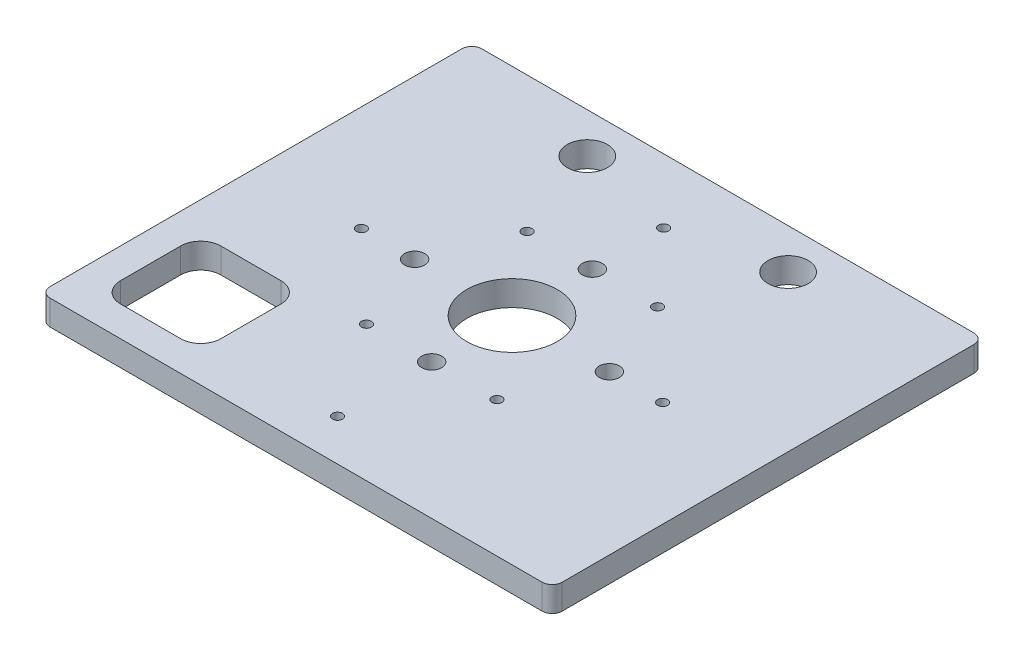
from build123d import *

# Parameters (mm, degrees)
SKETCH1_W           = 51
SKETCH1_H           = 43
SKETCH1_R           = 4.5
SKETCH1_R_2         = 1
SKETCH1_R_3         = 2
SKETCH1_R_4         = 0.5
BOSS_EXTRUDE1_DEPTH = 2.5
FILLET1_R           = 1


with BuildPart() as part:
    # Sketch1 → Boss-Extrude1 (new body)
    with BuildSketch(Plane(origin=(0, 0, 0), x_dir=(1, 0, 0), z_dir=(0, 1, 0))):
        Rectangle(SKETCH1_W, SKETCH1_H)
        with Locations(Location((0, 0, 0), (0, 0, 270))):
            Circle(SKETCH1_R, mode=Mode.SUBTRACT)
        with Locations(Location((9.7, 0, 0), (0, 0, 270))):
            Circle(SKETCH1_R_2, mode=Mode.SUBTRACT)
        with Locations(Location((-9.7, 0, 0), (0, 0, 270))):
            Circle(SKETCH1_R_2, mode=Mode.SUBTRACT)
        with Locations(Location((0, 8, 0), (0, 0, 270))):
            Circle(SKETCH1_R_2, mode=Mode.SUBTRACT)
        with Locations(Location((0, -8, 0), (0, 0, 270))):
            Circle(SKETCH1_R_2, mode=Mode.SUBTRACT)
        with Locations(Location((-10, 17.5, 0), (0, 0, 270))):
            Circle(SKETCH1_R_3, mode=Mode.SUBTRACT)
        with Locations(Location((10, 17.5, 0), (0, 0, 270))):
            Circle(SKETCH1_R_3, mode=Mode.SUBTRACT)
        with Locations(Location((-15, 0, 0), (0, 0, 270))):
            Circle(SKETCH1_R_4, mode=Mode.SUBTRACT)
        with Locations(Location((15, 0, 0), (0, 0, 270))):
            Circle(SKETCH1_R_4, mode=Mode.SUBTRACT)
        with Locations(Location((0, -17.375333522, 0), (0, 0, 270))):
            Circle(SKETCH1_R_4, mode=Mode.SUBTRACT)
        with Locations(Location((0, 15.103719109, 0), (0, 0, 270))):
            Circle(SKETCH1_R_4, mode=Mode.SUBTRACT)
        with Locations(Location((6.5, 8, 0), (0, 0, 270))):
            Circle(SKETCH1_R_4, mode=Mode.SUBTRACT)
        with Locations(Location((-6.5, 8, 0), (0, 0, 270))):
            Circle(SKETCH1_R_4, mode=Mode.SUBTRACT)
        with Locations(Location((-6.5, -8, 0), (0, 0, 270))):
            Circle(SKETCH1_R_4, mode=Mode.SUBTRACT)
        with Locations(Location((6.5, -8, 0), (0, 0, 270))):
            Circle(SKETCH1_R_4, mode=Mode.SUBTRACT)
        with BuildLine():
            Line((-20.5, -18.5), (-14.5, -18.5))
            ThreePointArc((-14.5, -18.5), (-13.085786438, -17.914213562), (-12.5, -16.5))
            Line((-12.5, -16.5), (-12.5, -10.5))
            ThreePointArc((-12.5, -10.5), (-13.085786438, -9.085786438), (-14.5, -8.5))
            Line((-14.5, -8.5), (-20.5, -8.5))
            ThreePointArc((-20.5, -8.5), (-21.914213562, -9.085786438), (-22.5, -10.5))
            Line((-22.5, -10.5), (-22.5, -16.5))
            ThreePointArc((-22.5, -16.5), (-21.914213562, -17.914213562), (-20.5, -18.5))
        make_face(mode=Mode.SUBTRACT)
    extrude(amount=BOSS_EXTRUDE1_DEPTH)

    # Fillet1
    fillet1_edges = [part.edges().sort_by_distance(p)[0] for p in [
        (25.5, 1.25, -21.5),
        (25.5, 1.25, 21.5),
        (-25.5, 1.25, 21.5),
        (-25.5, 1.25, -21.5),
    ]]
    fillet(fillet1_edges, radius=FILLET1_R)


solid = part.part
